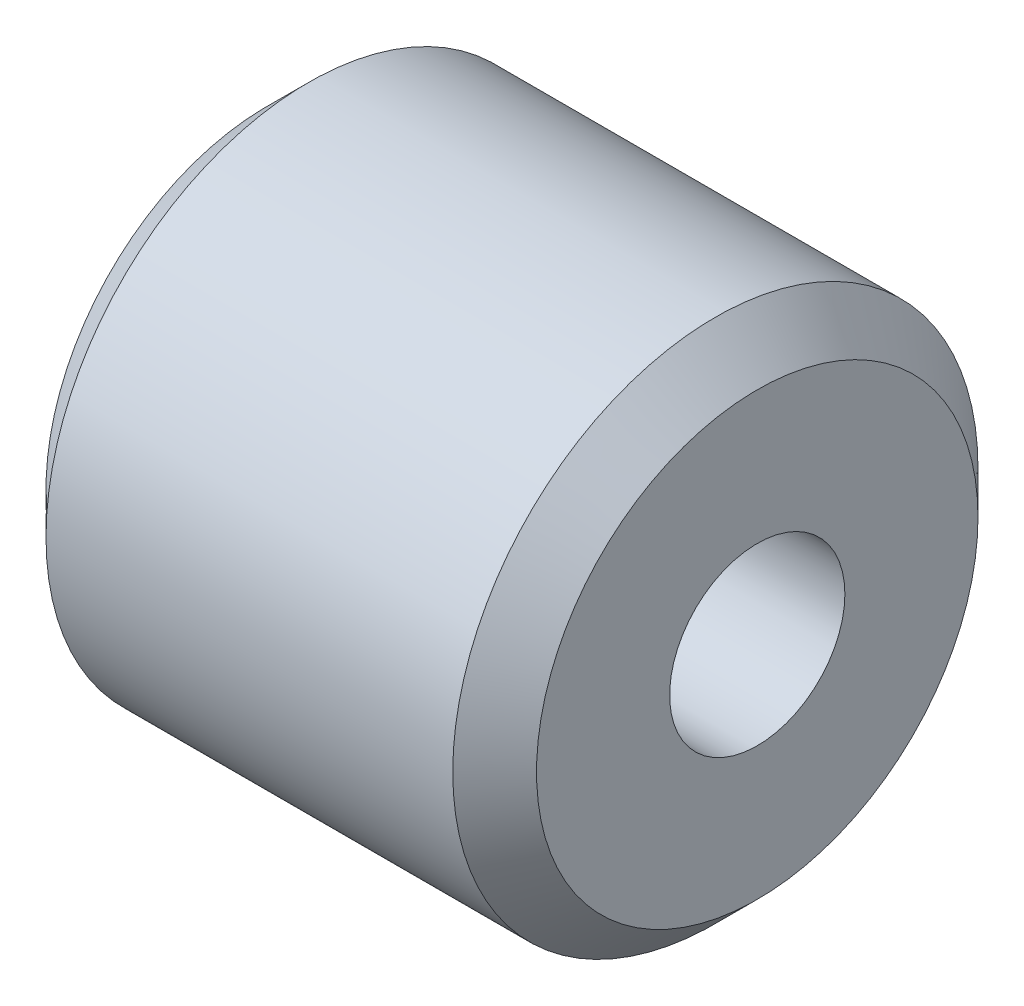
from build123d import *

# Parameters (mm, degrees)
SKETCH1_R           = 4.765
SKETCH1_R_2         = 1.59
BOSS_EXTRUDE1_DEPTH = 8.9
CHAMFER4_SIZE       = 0.76


with BuildPart() as part:
    # Sketch1 → Boss-Extrude1 (new body)
    with BuildSketch(Plane(origin=(0, 0, 0), x_dir=(0, 0, -1), z_dir=(1, 0, 0))):
        Circle(SKETCH1_R)
        Circle(SKETCH1_R_2, mode=Mode.SUBTRACT)
    extrude(amount=BOSS_EXTRUDE1_DEPTH)

    # Chamfer4
    chamfer4_edges = [part.edges().sort_by_distance(p)[0] for p in [
        (0, 0, 4.765),
        (8.9, 0, 4.765),
    ]]
    chamfer(chamfer4_edges, length=CHAMFER4_SIZE)


solid = part.part
